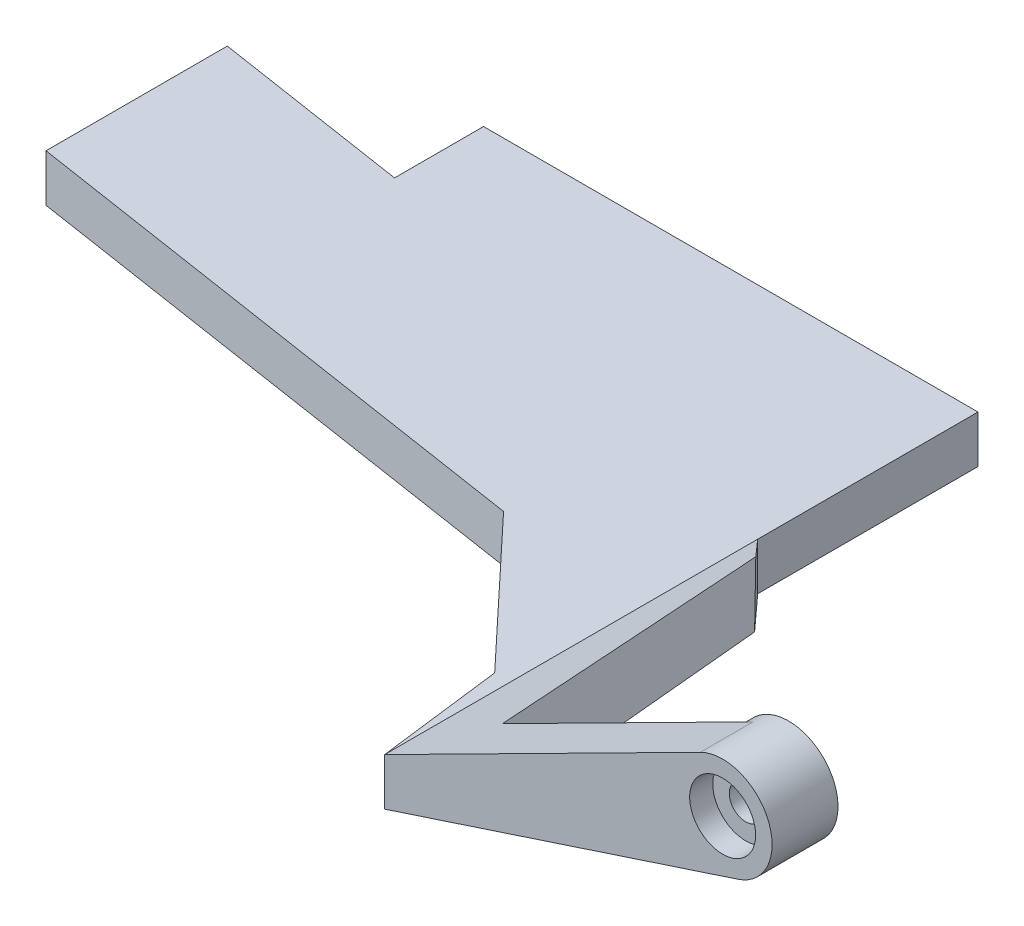
from build123d import *
from build123d.topology import SkipClean

# Parameters (mm, degrees)
CROQUIS1_R               = 6
CROQUIS1_R_2             = 5
SALIENTE_EXTRUIR1_DEPTH  = 10
SALIENTE_EXTRUIR2_START  = -7
CROQUIS2_R               = 5
CROQUIS2_R_2             = 2.5
SALIENTE_EXTRUIR2_DEPTH  = 7
CORTAR_EXTRUIR2_START    = -3.5
CROQUIS3_R               = 5
CORTAR_EXTRUIR2_DEPTH    = 3.5
CROQUIS4_R               = 6
CORTAR_EXTRUIR3_DEPTH    = 0.8
SALIENTE_EXTRUIR3_START  = -10
CROQUIS5_R               = 7.5
CROQUIS5_R_2             = 5
SALIENTE_EXTRUIR3_DEPTH  = 10
SALIENTE_EXTRUIR4_START  = -8
SALIENTE_EXTRUIR4_DEPTH  = 8
CROQUIS7_W               = 75
CROQUIS7_H               = 7.168726593
SALIENTE_EXTRUIR5_DEPTH  = 90
SALIENTE_EXTRUIR6_DEPTH  = 7.168727
SALIENTE_EXTRUIR9_DEPTH  = 41
SALIENTE_EXTRUIR10_DEPTH = 49
CORTAR_EXTRUIR4_START    = -41
CORTAR_EXTRUIR4_DEPTH    = 41
CORTAR_EXTRUIR5_DEPTH    = 143.675260973
CORTAR_EXTRUIR7_DEPTH    = 145.942427149
CORTAR_EXTRUIR8_DEPTH    = 145.942427149
CORTAR_EXTRUIR9_DEPTH    = 144.33727388
CROQUIS17_W              = 30
CROQUIS17_H              = 20.5
SALIENTE_EXTRUIR12_DEPTH = 7.168727
CORTAR_EXTRUIR10_DEPTH   = 170.800324178
SALIENTE_EXTRUIR13_DEPTH = 7.168727
SALIENTE_EXTRUIR14_DEPTH = 7.168727
SALIENTE_EXTRUIR15_DEPTH = 7.168727
SALIENTE_EXTRUIR16_DEPTH = 9.56851
CORTAR_EXTRUIR11_DEPTH   = 157.224659696
CORTAR_EXTRUIR12_DEPTH   = 157.224659696
CORTAR_EXTRUIR13_DEPTH   = 168.783904806
CORTAR_EXTRUIR14_DEPTH   = 171.537384562


with BuildPart() as part:
    # Croquis1 → Saliente-Extruir1 (new body)
    with BuildSketch(Plane.XY):
        with Locations((10, 0)):
            Circle(CROQUIS1_R)
        with Locations((10, 0)):
            Circle(CROQUIS1_R_2, mode=Mode.SUBTRACT)
    extrude(amount=SALIENTE_EXTRUIR1_DEPTH)

    # Croquis2 → Saliente-Extruir2 (add)
    with BuildSketch(Plane.XY.offset(10).offset(SALIENTE_EXTRUIR2_START)):
        with Locations((10, 0)):
            Circle(CROQUIS2_R)
        with Locations((10, 0)):
            Circle(CROQUIS2_R_2, mode=Mode.SUBTRACT)
    extrude(amount=SALIENTE_EXTRUIR2_DEPTH)

    # Croquis3 → Cortar-Extruir2 (cut)
    with BuildSketch(Plane.XY.offset(10).offset(CORTAR_EXTRUIR2_START)):
        with Locations((10, 0)):
            Circle(CROQUIS3_R)
    extrude(amount=CORTAR_EXTRUIR2_DEPTH, mode=Mode.SUBTRACT)

    # Croquis4 → Cortar-Extruir3 (cut)
    with BuildSketch(Plane(origin=(0, 0, 0), x_dir=(-1, 0, 0), z_dir=(0, 0, -1))):
        with Locations((-10, 0)):
            Circle(CROQUIS4_R)
    extrude(amount=-CORTAR_EXTRUIR3_DEPTH, mode=Mode.SUBTRACT)

    # Croquis5 → Saliente-Extruir3 (add)
    with BuildSketch(Plane.XY.offset(10).offset(SALIENTE_EXTRUIR3_START)):
        with Locations((10, 0)):
            Circle(CROQUIS5_R)
        with Locations((10, 0)):
            Circle(CROQUIS5_R_2, mode=Mode.SUBTRACT)
    extrude(amount=SALIENTE_EXTRUIR3_DEPTH)

    # Croquis6 → Saliente-Extruir4 (add)
    with BuildSketch(Plane.XY.offset(10).offset(SALIENTE_EXTRUIR4_START)):
        with BuildLine():
            Line((-41.267602672, -17.548326339), (6.612435502, 6.691368079))
            ThreePointArc((6.612435502, 6.691368079), (3.071368624, -2.871248378), (12.338451231, -7.126124181))
            Line((12.338451231, -7.126124181), (-41.267602672, -24.717052932))
            Line((-41.267602672, -24.717052932), (-41.267602672, -17.548326339))
        make_face()
    extrude(amount=SALIENTE_EXTRUIR4_DEPTH)

    # Croquis7 → Saliente-Extruir5 (add)
    with BuildSketch(Plane.XY.offset(10)):
        with Locations((-78.767602672, -21.132689636)):
            Rectangle(CROQUIS7_W, CROQUIS7_H)
    extrude(amount=-SALIENTE_EXTRUIR5_DEPTH)

    # Croquis8 → Saliente-Extruir6 (add)
    with SkipClean():  # the faces are left unmerged after this step: merging them gives an invalid solid
        with BuildSketch(Plane.XZ.offset(24.717052932)):
            Polygon((-27.979148649, 2), (-41.267602672, -39), (-41.267602672, 2), align=None)
        extrude(amount=-SALIENTE_EXTRUIR6_DEPTH)

    # Croquis10 → Saliente-Extruir9 (add)
    with BuildSketch(Plane(origin=(0, 0, 2), x_dir=(-1, 0, 0), z_dir=(0, 0, -1))):
        Polygon((41.267602672, -17.548326339), (27.979148649, -17.548326339), (27.979148649, -10.820928511), align=None)
    extrude(amount=SALIENTE_EXTRUIR9_DEPTH)

    # Croquis11 → Saliente-Extruir10 (add)
    with BuildSketch(Plane(origin=(0, 0, -39), x_dir=(-1, 0, 0), z_dir=(0, 0, -1))):
        Polygon((41.267602672, -17.548326339), (41.267602672, -24.717052932), (27.979148649, -20.356421419), (27.979148649, -17.548326339), align=None)
    extrude(amount=-SALIENTE_EXTRUIR10_DEPTH)

    # Croquis12 → Cortar-Extruir4 (cut)
    with BuildSketch(Plane.XY.offset(2).offset(CORTAR_EXTRUIR4_START)):
        Polygon((-41.267602672, -24.717052932), (-27.979148649, -20.356421419), (-27.979148649, -24.717052932), align=None)
    extrude(amount=CORTAR_EXTRUIR4_DEPTH, mode=Mode.SUBTRACT)

    # Croquis13 → Cortar-Extruir5 (cut, through all)
    with BuildSketch(Plane(origin=(-1.347459035, 2.6616008, 0), x_dir=(0.89218241056854, 0.45167526639402034, 0), z_dir=(-0.45167526639402034, 0.89218241056854, 0))):
        Polygon((-29.850050056, -2), (-37.29721213, 39), (-29.850050056, 39), align=None)
    extrude(amount=-CORTAR_EXTRUIR5_DEPTH, mode=Mode.SUBTRACT)

    # Croquis14 → Cortar-Extruir7 (cut, through all)
    with BuildSketch(Plane(origin=(3.310603082, -10.088629756, 0), x_dir=(0.9501498907741007, 0.31179349746581414, 0), z_dir=(0.3117934974658141, -0.9501498907741006, 0))):
        Polygon((-29.95828018, 2), (-32.931384863, 2), (-36.10801617, -39), align=None)
    extrude(amount=-CORTAR_EXTRUIR7_DEPTH, mode=Mode.SUBTRACT)


with BuildPart() as cortar_extruir7_piece_1:
    # of the separate pieces the step leaves, piece 1, a body of its own (cortar_extruir7_pieces)
    add(part.part.solids().sort_by_distance((12.338451231, -7.126124181, 10))[0])


with BuildPart() as cortar_extruir7_piece_2:
    # of the separate pieces the step leaves, piece 2, a body of its own (cortar_extruir7_pieces)
    add(part.part.solids().sort_by_distance((-27.979148649, -20.356421419, -21.711689973))[0])


with BuildPart() as cortar_extruir8_tool:
    # Croquis15 → Cortar-Extruir8 (new, through all)
    with BuildSketch(Plane(origin=(3.310603082, -10.088629756, 0), x_dir=(0.9501498907741007, 0.31179349746581414, 0), z_dir=(0.3117934974658141, -0.9501498907741006, 0))):
        Polygon((-26.166370626, 2), (-33.745414131, 2), (-39.42969676, -39), (-33.745414131, -39), align=None)
    extrude(amount=-CORTAR_EXTRUIR8_DEPTH)


with BuildPart() as cortar_extruir7_piece_1_1:
    add(cortar_extruir7_piece_1.part)

    # Cortar-Extruir8: cut by cortar_extruir8_tool
    add(cortar_extruir8_tool.part, mode=Mode.SUBTRACT)

    # Croquis16 → Cortar-Extruir9 (cut, through all)
    with BuildSketch(Plane(origin=(0, -17.548326339, 0), x_dir=(1, 0, 0), z_dir=(0, 1, 0))):
        Polygon((-41.267602672, -10), (-46.041400107, 28.151463514), (-116.267602672, 39), (-116.267602672, -10), align=None)
    extrude(amount=-CORTAR_EXTRUIR9_DEPTH, mode=Mode.SUBTRACT)

    # Croquis17 → Saliente-Extruir12 (add)
    with SkipClean():  # the faces are left unmerged after this step: merging them gives an invalid solid
        with BuildSketch(Plane.XZ.offset(24.717052932)):
            with Locations((-131.267602672, -49.25)):
                Rectangle(CROQUIS17_W, CROQUIS17_H)
        extrude(amount=-SALIENTE_EXTRUIR12_DEPTH)

    # Croquis18 → Cortar-Extruir10 (cut, through all)
    with SkipClean():  # the faces are left unmerged after this step: merging them gives an invalid solid
        with BuildSketch(Plane.XZ.offset(24.717052932)):
            Polygon((-146.267602672, -59.5), (-116.267602672, -59.5), (-146.267602672, -64.144245374), align=None)
            Polygon((-116.267602672, -39), (-146.267602672, -43.634396888), (-146.267602672, -39), align=None)
        extrude(amount=-CORTAR_EXTRUIR10_DEPTH, mode=Mode.SUBTRACT)

    # Croquis19 → Saliente-Extruir13 (add)
    with BuildSketch(Plane.XZ.offset(24.717052932)):
        Polygon((-146.267602672, -59.5), (-116.267602672, -59.5), (-146.267602672, -64.134396888), align=None)
    extrude(amount=-SALIENTE_EXTRUIR13_DEPTH)

    # Croquis20 → Saliente-Extruir14 (add)
    with BuildSketch(Plane.XZ.offset(24.717052932)):
        Polygon((-146.267602672, -64.134396888), (-116.267602672, -59.5), (-116.267602672, -66.5), (-146.267602672, -71.134396888), align=None)
    extrude(amount=-SALIENTE_EXTRUIR14_DEPTH)

    # Croquis21 → Saliente-Extruir15 (add)
    with SkipClean():  # the faces are left unmerged after this step: merging them gives an invalid solid
        with BuildSketch(Plane.XZ.offset(24.717052932)):
            Polygon((-43.654501389, -9.075731757), (-64.181393268, -30.953727775), (-46.041400107, -28.151463514), align=None)
        extrude(amount=-SALIENTE_EXTRUIR15_DEPTH)

    # Croquis22 → Saliente-Extruir16 (add)
    with SkipClean():  # the faces are left unmerged after this step: merging them gives an invalid solid
        with BuildSketch(Plane.XZ.offset(24.717052932)):
            Polygon((-41.267602672, -39), (-34.153518988, -39), (-41.267602672, -46.58234103), align=None)
        extrude(amount=-SALIENTE_EXTRUIR16_DEPTH)

    # Croquis23 → Cortar-Extruir11 (cut, through all)
    with SkipClean():  # the faces are left unmerged after this step: merging them gives an invalid solid
        with BuildSketch(Plane.XY.offset(-39)):
            Polygon((-41.267602672, -17.548326339), (-41.267602672, -15.148543026), (-36.527373087, -15.148543026), align=None)
            Polygon((-41.267602672, -24.717052932), (-34.153518988, -22.382552813), (-34.153518988, -24.717052932), align=None)
        extrude(amount=-CORTAR_EXTRUIR11_DEPTH, mode=Mode.SUBTRACT)

    # Croquis24 → Cortar-Extruir12 (cut, through all)
    with SkipClean():  # the faces are left unmerged after this step: merging them gives an invalid solid
        with BuildSketch(Plane.XY.offset(-39)):
            Polygon((-36.527373087, -15.148543026), (-34.153518988, -15.148543026), (-34.153518988, -22.382552813), align=None)
        extrude(amount=-CORTAR_EXTRUIR12_DEPTH, mode=Mode.SUBTRACT)

    # Croquis25 → Cortar-Extruir13 (cut, through all)
    with SkipClean():  # the faces are left unmerged after this step: merging them gives an invalid solid
        with BuildSketch(Plane(origin=(-1.347459035, 2.6616008, 0), x_dir=(0.89218241056854, 0.45167526639402034, 0), z_dir=(-0.45167526639402034, 0.89218241056854, 0))):
            Polygon((-39.431301979, 39), (-39.840751663, 41.919452496), (-39.431301979, 41.530103964), align=None)
        extrude(amount=-CORTAR_EXTRUIR13_DEPTH, mode=Mode.SUBTRACT)

    # Croquis26 → Cortar-Extruir14 (cut, through all)
    with SkipClean():  # the faces are left unmerged after this step: merging them gives an invalid solid
        with BuildSketch(Plane(origin=(3.310603082, -10.088629756, 0), x_dir=(0.9501498907741007, 0.31179349746581414, 0), z_dir=(0.3117934974658141, -0.9501498907741006, 0))):
            Polygon((-39.42969676, -39), (-39.83445269, -41.919452496), (-39.42969676, -40.933309055), align=None)
        extrude(amount=-CORTAR_EXTRUIR14_DEPTH, mode=Mode.SUBTRACT)


with BuildPart() as cortar_extruir7_piece_2_1:
    add(cortar_extruir7_piece_2.part)

    # Cortar-Extruir8: cut by cortar_extruir8_tool
    add(cortar_extruir8_tool.part, mode=Mode.SUBTRACT)


solid = cortar_extruir7_piece_1_1.part
